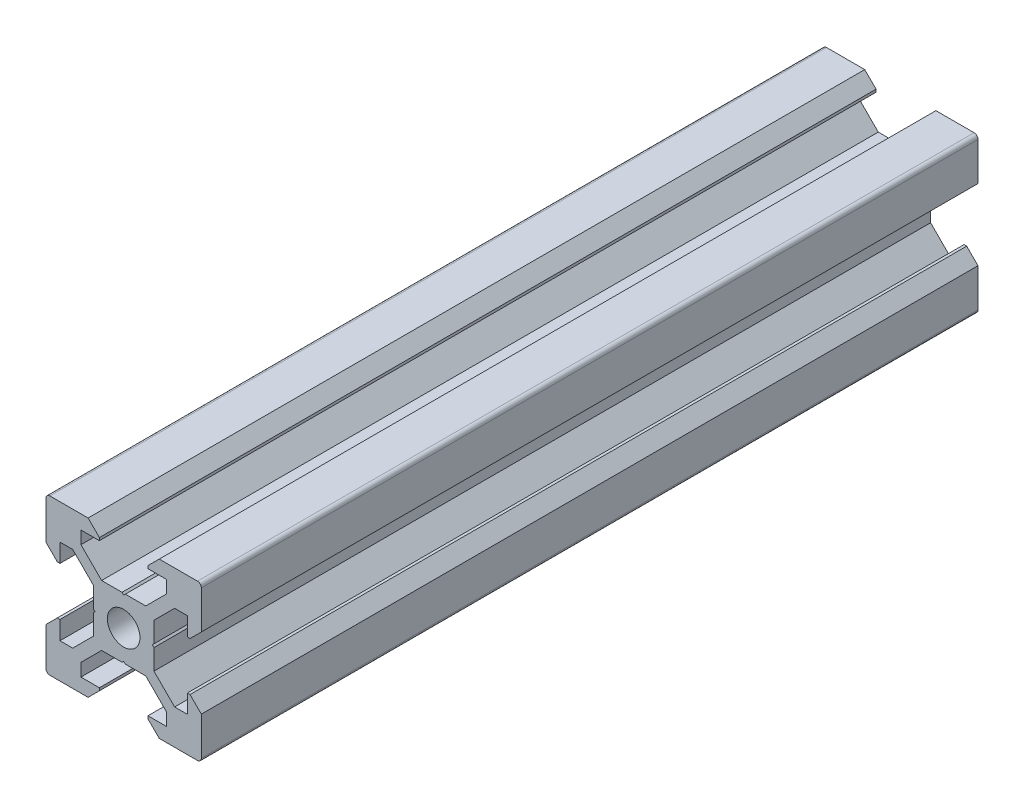
from build123d import *

# Parameters (mm, degrees)
SKETCH1_R           = 2.1
BOSS_EXTRUDE1_DEPTH = 100


with BuildPart() as part:
    # Sketch1 → Boss-Extrude1 (new body)
    with BuildSketch(Plane.XY):
        with BuildLine():
            Line((4.58, -10), (9.5, -10))
            ThreePointArc((9.5, -10), (9.853553391, -9.853553391), (10, -9.5))
            Line((10, -9.5), (10, -4.58))
            Line((10, -4.58), (8.545, -3.125))
            Line((8.545, -3.125), (8.2, -3.125))
            Line((8.2, -3.125), (8.2, -5.5))
            Line((8.2, -5.5), (6.560660172, -5.5))
            Line((6.560660172, -5.5), (3.9, -2.839339828))
            Line((3.9, -2.839339828), (3.9, -0.21))
            Line((3.9, -0.21), (3.69, 0))
            Line((3.69, 0), (3.9, 0.21))
            Line((3.9, 0.21), (3.9, 2.839339828))
            Line((3.9, 2.839339828), (6.560660172, 5.5))
            Line((6.560660172, 5.5), (8.2, 5.5))
            Line((8.2, 5.5), (8.2, 3.125))
            Line((8.2, 3.125), (8.545, 3.125))
            Line((8.545, 3.125), (10, 4.58))
            Line((10, 4.58), (10, 9.5))
            ThreePointArc((10, 9.5), (9.853553391, 9.853553391), (9.5, 10))
            Line((9.5, 10), (4.58, 10))
            Line((4.58, 10), (3.125, 8.545))
            Line((3.125, 8.545), (3.125, 8.2))
            Line((3.125, 8.2), (5.5, 8.2))
            Line((5.5, 8.2), (5.5, 6.560660172))
            Line((5.5, 6.560660172), (2.839339828, 3.9))
            Line((2.839339828, 3.9), (0.21, 3.9))
            Line((0.21, 3.9), (0, 3.69))
            Line((0, 3.69), (-0.21, 3.9))
            Line((-0.21, 3.9), (-2.839339828, 3.9))
            Line((-2.839339828, 3.9), (-5.5, 6.560660172))
            Line((-5.5, 6.560660172), (-5.5, 8.2))
            Line((-5.5, 8.2), (-3.125, 8.2))
            Line((-3.125, 8.2), (-3.125, 8.545))
            Line((-3.125, 8.545), (-4.58, 10))
            Line((-4.58, 10), (-9.5, 10))
            ThreePointArc((-9.5, 10), (-9.853553391, 9.853553391), (-10, 9.5))
            Line((-10, 9.5), (-10, 4.58))
            Line((-10, 4.58), (-8.545, 3.125))
            Line((-8.545, 3.125), (-8.2, 3.125))
            Line((-8.2, 3.125), (-8.2, 5.5))
            Line((-8.2, 5.5), (-6.560660172, 5.5))
            Line((-6.560660172, 5.5), (-3.9, 2.839339828))
            Line((-3.9, 2.839339828), (-3.9, 0.21))
            Line((-3.9, 0.21), (-3.69, 0))
            Line((-3.69, 0), (-3.9, -0.21))
            Line((-3.9, -0.21), (-3.9, -2.839339828))
            Line((-3.9, -2.839339828), (-6.560660172, -5.5))
            Line((-6.560660172, -5.5), (-8.2, -5.5))
            Line((-8.2, -5.5), (-8.2, -3.125))
            Line((-8.2, -3.125), (-8.545, -3.125))
            Line((-8.545, -3.125), (-10, -4.58))
            Line((-10, -4.58), (-10, -9.5))
            ThreePointArc((-10, -9.5), (-9.853553391, -9.853553391), (-9.5, -10))
            Line((-9.5, -10), (-4.58, -10))
            Line((-4.58, -10), (-3.125, -8.545))
            Line((-3.125, -8.545), (-3.125, -8.2))
            Line((-3.125, -8.2), (-5.5, -8.2))
            Line((-5.5, -8.2), (-5.5, -6.560660172))
            Line((-5.5, -6.560660172), (-2.839339828, -3.9))
            Line((-2.839339828, -3.9), (-0.21, -3.9))
            Line((-0.21, -3.9), (0, -3.69))
            Line((0, -3.69), (0.21, -3.9))
            Line((0.21, -3.9), (2.839339828, -3.9))
            Line((2.839339828, -3.9), (5.5, -6.560660172))
            Line((5.5, -6.560660172), (5.5, -8.2))
            Line((5.5, -8.2), (3.125, -8.2))
            Line((3.125, -8.2), (3.125, -8.545))
            Line((3.125, -8.545), (4.58, -10))
        make_face()
        Circle(SKETCH1_R, mode=Mode.SUBTRACT)
    extrude(amount=BOSS_EXTRUDE1_DEPTH)


solid = part.part
